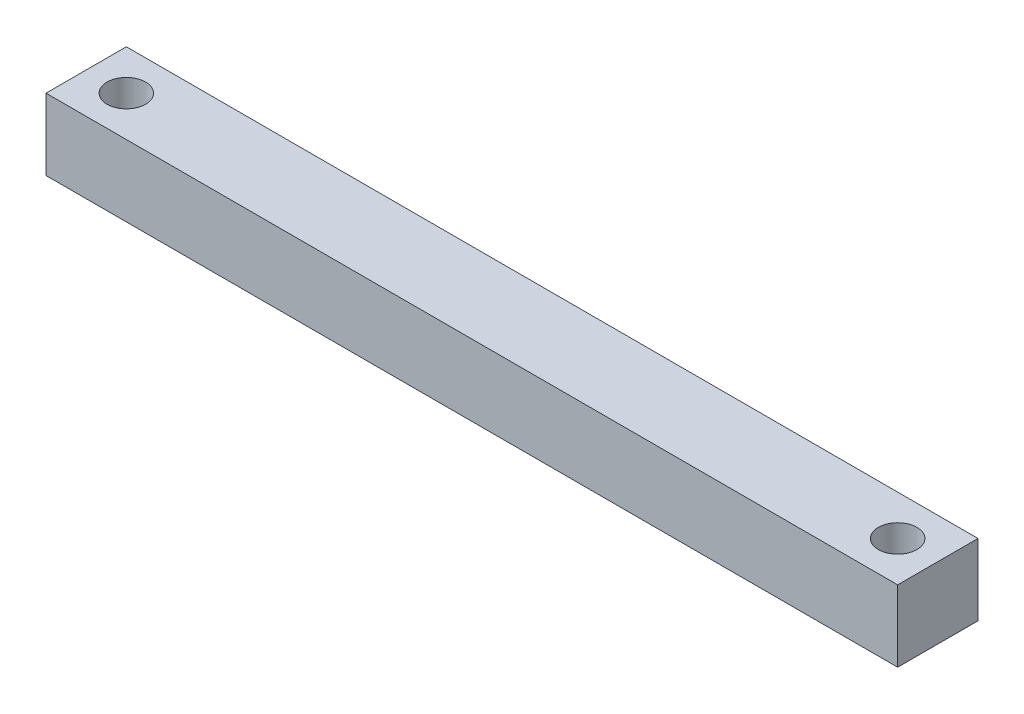
from build123d import *

# Parameters (mm, degrees)
SKETCH1_W           = 336.55
SKETCH1_H           = 31.75
SKETCH1_R           = 7.62
BOSS_EXTRUDE1_DEPTH = 28.194


with BuildPart() as part:
    # Sketch1 → Boss-Extrude1 (new body)
    with BuildSketch(Plane(origin=(0, 0, 0), x_dir=(1, 0, 0), z_dir=(0, 1, 0))):
        with Locations((168.275, 15.875)):
            Rectangle(SKETCH1_W, SKETCH1_H)
        with Locations(Location((15.875, 15.875, 0), (0, 0, 270))):
            Circle(SKETCH1_R, mode=Mode.SUBTRACT)
        with Locations(Location((320.675, 15.875, 0), (0, 0, 270))):
            Circle(SKETCH1_R, mode=Mode.SUBTRACT)
    extrude(amount=BOSS_EXTRUDE1_DEPTH)


solid = part.part
